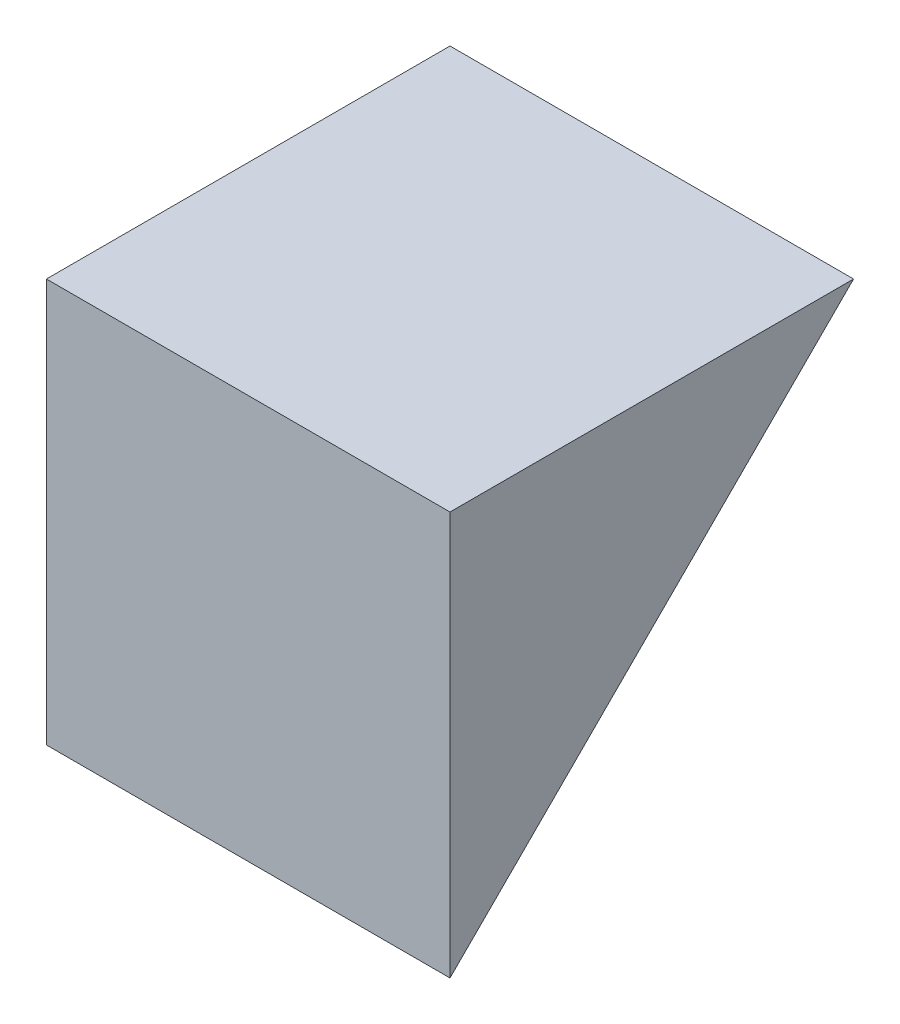
from build123d import *

# Parameters (mm, degrees)
BOSS_EXTRUDE1_DEPTH = 40


with BuildPart() as part:
    # Sketch1 → Boss-Extrude1 (new body)
    with BuildSketch(Plane(origin=(0, 0, 0), x_dir=(0, 0, -1), z_dir=(1, 0, 0))):
        Polygon((0, 0), (-40, 0), (-40, -40), align=None)
    extrude(amount=BOSS_EXTRUDE1_DEPTH)


solid = part.part
